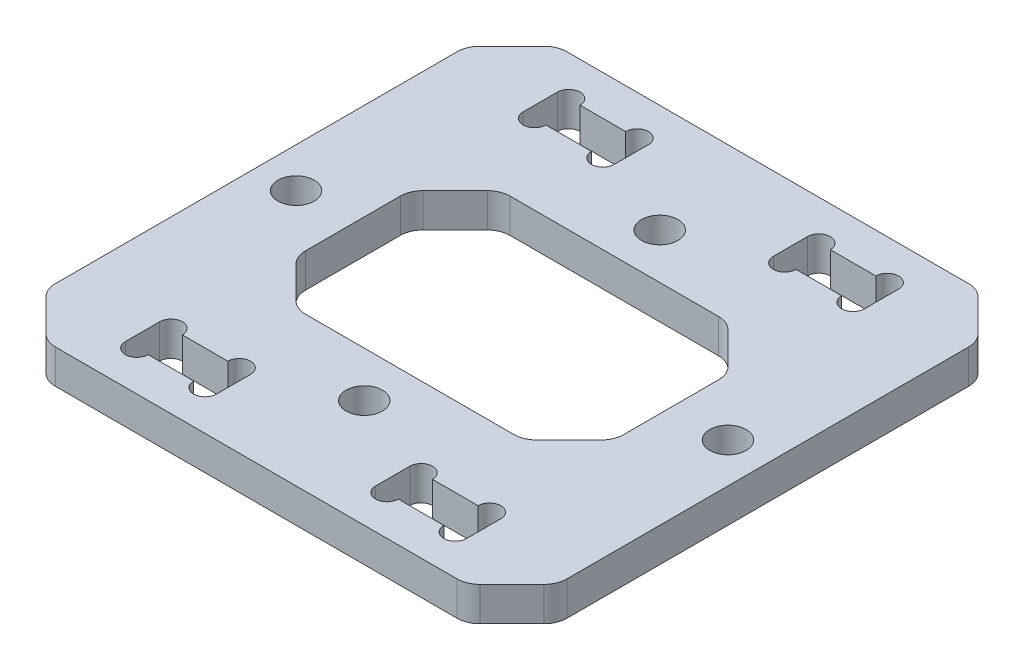
from build123d import *

# Parameters (mm, degrees)
SKETCH_1_W          = 45
SKETCH_1_H          = 45
SKETCH_1_R          = 1.6
EXTRUDE_1_DEPTH     = 3
SKETCH_2_W          = 8.01
SKETCH_2_H          = 3.01
CUT_EXTRUDE_1_DEPTH = 3
SKETCH_4_R          = 1
SKETCH_4_R_2        = 1.6
CUT_EXTRUDE_2_DEPTH = 3
SKETCH_5_W          = 28
SKETCH_5_H          = 18
CUT_EXTRUDE_3_DEPTH = 3
CHAMFER_1_SIZE      = 4
FILLET_1_R          = 2


with BuildPart() as part:
    # 草图1 → 凸台-拉伸1 (new body)
    with BuildSketch(Plane(origin=(0, 0, 0), x_dir=(1, 0, 0), z_dir=(0, 1, 0))):
        Rectangle(SKETCH_1_W, SKETCH_1_H)
        with Locations(Location((19, 0, 0), (0, 0, 270))):
            Circle(SKETCH_1_R, mode=Mode.SUBTRACT)
        with Locations(Location((-19, 0, 0), (0, 0, 270))):
            Circle(SKETCH_1_R, mode=Mode.SUBTRACT)
    extrude(amount=EXTRUDE_1_DEPTH)

    # 草图2 → 切除-拉伸1 (cut)
    with BuildSketch(Plane(origin=(0, 3, 0), x_dir=(1, 0, 0), z_dir=(0, 1, 0))):
        with Locations((-11.005, -17.5)):
            Rectangle(SKETCH_2_W, SKETCH_2_H)
        with Locations((11.005, -17.5)):
            Rectangle(SKETCH_2_W, SKETCH_2_H)
        with Locations((-11.005, 17.5)):
            Rectangle(SKETCH_2_W, SKETCH_2_H)
        with Locations((11.005, 17.5)):
            Rectangle(SKETCH_2_W, SKETCH_2_H)
    extrude(amount=-CUT_EXTRUDE_1_DEPTH, mode=Mode.SUBTRACT)

    # 草图4 → 切除-拉伸2 (cut)
    with BuildSketch(Plane(origin=(0, 3, 0), x_dir=(1, 0, 0), z_dir=(0, 1, 0))):
        with Locations((-14.01, -15.995)):
            Circle(SKETCH_4_R)
        with Locations((-14.01, -19.005)):
            Circle(SKETCH_4_R)
        with Locations((-8, -15.995)):
            Circle(SKETCH_4_R)
        with Locations((-8, -19.005)):
            Circle(SKETCH_4_R)
        with Locations((8, -19.005)):
            Circle(SKETCH_4_R)
        with Locations((8, -15.995)):
            Circle(SKETCH_4_R)
        with Locations((14.01, -19.005)):
            Circle(SKETCH_4_R)
        with Locations((14.01, -15.995)):
            Circle(SKETCH_4_R)
        with Locations((-8, 19.005)):
            Circle(SKETCH_4_R)
        with Locations((-8, 15.995)):
            Circle(SKETCH_4_R)
        with Locations((-14.01, 19.005)):
            Circle(SKETCH_4_R)
        with Locations((-14.01, 15.995)):
            Circle(SKETCH_4_R)
        with Locations((14.01, 15.995)):
            Circle(SKETCH_4_R)
        with Locations((14.01, 19.005)):
            Circle(SKETCH_4_R)
        with Locations((8, 15.995)):
            Circle(SKETCH_4_R)
        with Locations((8, 19.005)):
            Circle(SKETCH_4_R)
        with Locations(Location((0, -13, 0), (0, 0, 270))):
            Circle(SKETCH_4_R_2)
        with Locations(Location((0, 13, 0), (0, 0, 90))):
            Circle(SKETCH_4_R_2)
    extrude(amount=-CUT_EXTRUDE_2_DEPTH, mode=Mode.SUBTRACT)

    # 草图5 → 切除-拉伸3 (cut)
    with BuildSketch(Plane(origin=(0, 3, 0), x_dir=(1, 0, 0), z_dir=(0, 1, 0))):
        Rectangle(SKETCH_5_W, SKETCH_5_H)
    extrude(amount=-CUT_EXTRUDE_3_DEPTH, mode=Mode.SUBTRACT)

    # 倒角1
    chamfer_1_edges = [part.edges().sort_by_distance(p)[0] for p in [
        (14, 1.5, -9),
        (14, 1.5, 9),
        (-14, 1.5, 9),
        (-14, 1.5, -9),
        (22.5, 1.5, 22.5),
        (-22.5, 1.5, 22.5),
        (-22.5, 1.5, -22.5),
        (22.5, 1.5, -22.5),
    ]]
    chamfer(chamfer_1_edges, length=CHAMFER_1_SIZE)

    # 圆角1
    fillet_1_edges = [part.edges().sort_by_distance(p)[0] for p in [
        (-22.5, 1.5, 18.5),
        (-22.5, 1.5, -18.5),
        (18.5, 1.5, -22.5),
        (-18.5, 1.5, -22.5),
        (22.5, 1.5, 18.5),
        (22.5, 1.5, -18.5),
        (-18.5, 1.5, 22.5),
        (18.5, 1.5, 22.5),
        (10, 1.5, 9),
        (-10, 1.5, 9),
        (-14, 1.5, -5),
        (-14, 1.5, 5),
        (14, 1.5, -5),
        (14, 1.5, 5),
        (-10, 1.5, -9),
        (10, 1.5, -9),
    ]]
    fillet(fillet_1_edges, radius=FILLET_1_R)


solid = part.part
